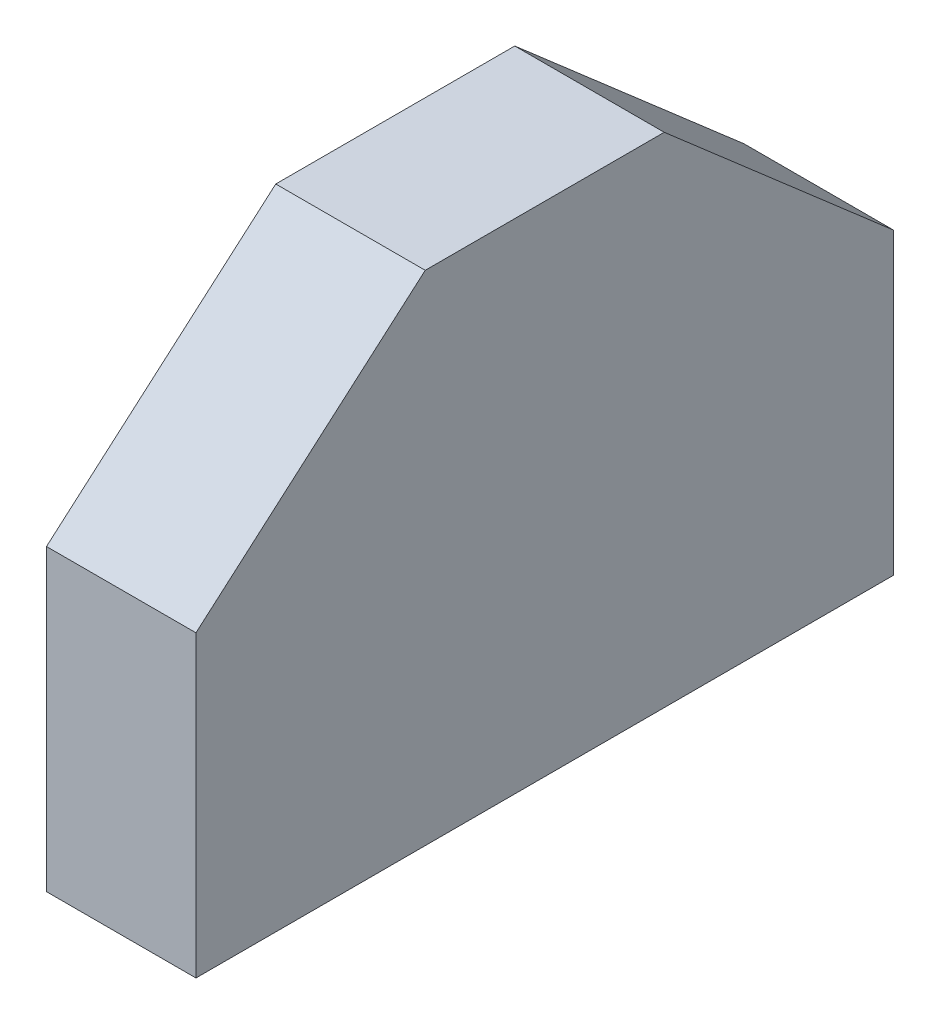
from build123d import *
from OCP.BRepFilletAPI import BRepFilletAPI_MakeChamfer

# Parameters (mm, degrees)
ESQUISSE1_W             = 15
ESQUISSE1_H             = 70
BOSS_EXTRU_1_DEPTH      = 50
CHANFREIN1_SIZE         = 20
CHANFREIN1_SIZE2        = 23.007368144
ESQUISSE2_W             = 9
ESQUISSE2_H             = 64
ENL_V_MAT_EXTRU_1_DEPTH = 30


with BuildPart() as part:
    # Esquisse1 → Boss.-Extru.1 (new body)
    with BuildSketch(Plane(origin=(0, 0, 0), x_dir=(1, 0, 0), z_dir=(0, 1, 0))):
        Rectangle(ESQUISSE1_W, ESQUISSE1_H)
    extrude(amount=BOSS_EXTRU_1_DEPTH)

    # Chanfrein1: one chamfer whose edges measure the first distance from different faces: ONE call of the kernel's chamfer builder (chamfer() names one face for all edges)
    chanfrein1_edges_1 = [part.edges().sort_by_distance(p)[0] for p in [
        (0, 50, -35),
    ]]
    chanfrein1_side_1 = [part.faces().sort_by_distance(p)[0] for p in [
        (0, 25, -35),
    ]]
    chanfrein1_edges_2 = [part.edges().sort_by_distance(p)[0] for p in [
        (0, 50, 35),
    ]]
    chanfrein1_side_2 = [part.faces().sort_by_distance(p)[0] for p in [
        (0, 25, 35),
    ]]
    chanfrein1 = BRepFilletAPI_MakeChamfer(part.part.solid().wrapped)
    for e in chanfrein1_edges_1:
        chanfrein1.Add(CHANFREIN1_SIZE, CHANFREIN1_SIZE2, e.wrapped, chanfrein1_side_1[0].wrapped)  # the first distance lies on this face
    for e in chanfrein1_edges_2:
        chanfrein1.Add(CHANFREIN1_SIZE, CHANFREIN1_SIZE2, e.wrapped, chanfrein1_side_2[0].wrapped)  # the first distance lies on this face
    add(Compound.cast(chanfrein1.Shape()), mode=Mode.REPLACE)

    # Esquisse2 → Enlèv. mat.-Extru.1 (cut)
    with BuildSketch(Plane.XZ):
        Rectangle(ESQUISSE2_W, ESQUISSE2_H)
    extrude(amount=-ENL_V_MAT_EXTRU_1_DEPTH, mode=Mode.SUBTRACT)


solid = part.part
